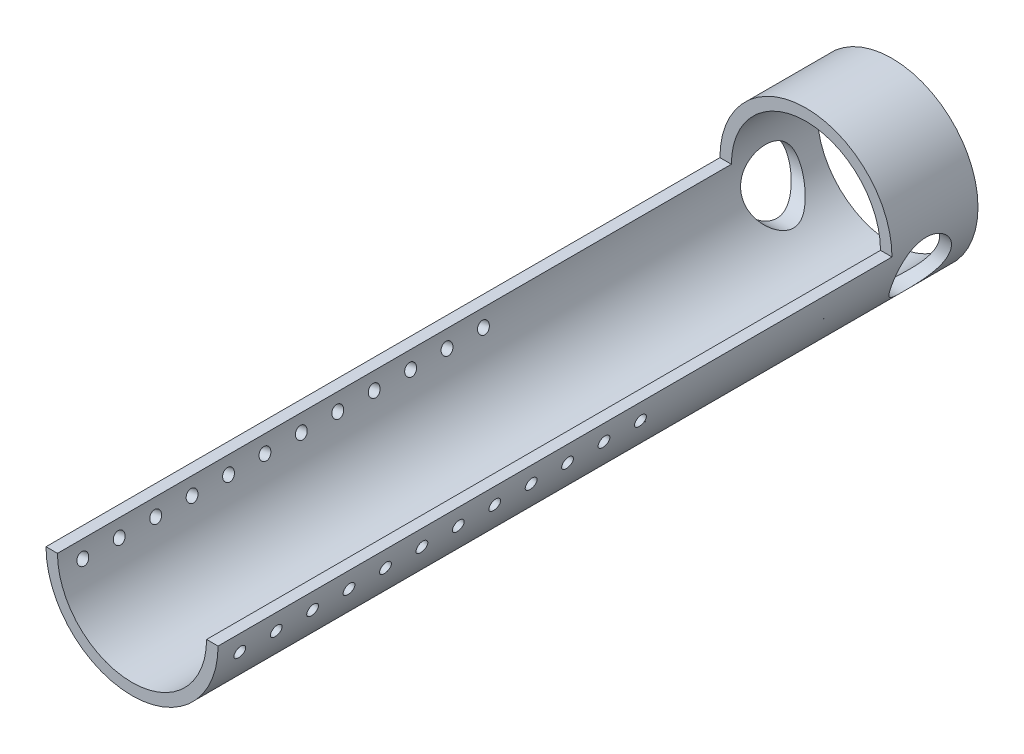
from build123d import *

# Parameters (mm, degrees)
SKETCH1_R               = 30
SKETCH1_R_2             = 26
BOSS_EXTRUDE1_DEPTH     = 132.5
SKETCH3_W               = 60
SKETCH3_H               = 30
CUT_EXTRUDE1_DEPTH      = 235
F_10_32_TAPPED_HOLE1_D  = 4.0386
LPATTERN1_COUNT         = 12
LPATTERN1_PITCH         = 12.7
MIRROR1_COPY_1_D        = 4.0386
MIRROR1_COPY_2_D        = 4.0386
MIRROR1_COPY_3_D        = 4.0386
MIRROR1_COPY_4_D        = 4.0386
MIRROR1_COPY_5_D        = 4.0386
MIRROR1_COPY_6_D        = 4.0386
MIRROR1_COPY_7_D        = 4.0386
MIRROR1_COPY_8_D        = 4.0386
MIRROR1_COPY_9_D        = 4.0386
MIRROR1_COPY_10_D       = 4.0386
MIRROR1_COPY_11_D       = 4.0386
MIRROR1_COPY_12_D       = 4.0386
CUT_EXTRUDE2_DEPTH      = 140.126740918
CUT_EXTRUDE2_DEPTH_BACK = 140.126740918
SKETCH8_R               = 10.16


with BuildPart() as part:
    # Sketch1 → Boss-Extrude1 (new, symmetric)
    with BuildSketch(Plane.XY):
        Circle(SKETCH1_R)
        Circle(SKETCH1_R_2, mode=Mode.SUBTRACT)
    extrude(amount=BOSS_EXTRUDE1_DEPTH, both=True)

    # Sketch3 → Cut-Extrude1 (cut)
    with BuildSketch(Plane.XY.offset(132.5)):
        with Locations((0, 15)):
            Rectangle(SKETCH3_W, SKETCH3_H)
    extrude(amount=-CUT_EXTRUDE1_DEPTH, mode=Mode.SUBTRACT)

    # #10-32 Tapped Hole1 (through all)
    with Locations(Plane(origin=(29.327958333, -6.314337653, 124.245976981), x_dir=(0.210477921772, 0.977598611111, 0), z_dir=(0.977598611111, -0.210477921772, 0))):
        with Locations((0, 0)):
            f_10_32_tapped_hole1 = Hole(F_10_32_TAPPED_HOLE1_D / 2)

    # LPattern1: #10-32 Tapped Hole1 ×12
    with Locations(*[(0, 0, -i * LPATTERN1_PITCH) for i in range(1, LPATTERN1_COUNT)]):
        add(f_10_32_tapped_hole1, mode=Mode.SUBTRACT)

    # Mirror1 copy 1 (through all)
    with Locations(Plane(origin=(-29.327958333, -6.314337653, 111.545976981), x_dir=(-0.210477921772, 0.977598611111, 0), z_dir=(-0.977598611111, -0.210477921772, 0))):
        with Locations((0, 0)):
            Hole(MIRROR1_COPY_1_D / 2)

    # Mirror1 copy 2 (through all)
    with Locations(Plane(origin=(-29.327958333, -6.314337653, 98.845976981), x_dir=(-0.210477921772, 0.977598611111, 0), z_dir=(-0.977598611111, -0.210477921772, 0))):
        with Locations((0, 0)):
            Hole(MIRROR1_COPY_2_D / 2)

    # Mirror1 copy 3 (through all)
    with Locations(Plane(origin=(-29.327958333, -6.314337653, 86.145976981), x_dir=(-0.210477921772, 0.977598611111, 0), z_dir=(-0.977598611111, -0.210477921772, 0))):
        with Locations((0, 0)):
            Hole(MIRROR1_COPY_3_D / 2)

    # Mirror1 copy 4 (through all)
    with Locations(Plane(origin=(-29.327958333, -6.314337653, 73.445976981), x_dir=(-0.210477921772, 0.977598611111, 0), z_dir=(-0.977598611111, -0.210477921772, 0))):
        with Locations((0, 0)):
            Hole(MIRROR1_COPY_4_D / 2)

    # Mirror1 copy 5 (through all)
    with Locations(Plane(origin=(-29.327958333, -6.314337653, 60.745976981), x_dir=(-0.210477921772, 0.977598611111, 0), z_dir=(-0.977598611111, -0.210477921772, 0))):
        with Locations((0, 0)):
            Hole(MIRROR1_COPY_5_D / 2)

    # Mirror1 copy 6 (through all)
    with Locations(Plane(origin=(-29.327958333, -6.314337653, 48.045976981), x_dir=(-0.210477921772, 0.977598611111, 0), z_dir=(-0.977598611111, -0.210477921772, 0))):
        with Locations((0, 0)):
            Hole(MIRROR1_COPY_6_D / 2)

    # Mirror1 copy 7 (through all)
    with Locations(Plane(origin=(-29.327958333, -6.314337653, 35.345976981), x_dir=(-0.210477921772, 0.977598611111, 0), z_dir=(-0.977598611111, -0.210477921772, 0))):
        with Locations((0, 0)):
            Hole(MIRROR1_COPY_7_D / 2)

    # Mirror1 copy 8 (through all)
    with Locations(Plane(origin=(-29.327958333, -6.314337653, 22.645976981), x_dir=(-0.210477921772, 0.977598611111, 0), z_dir=(-0.977598611111, -0.210477921772, 0))):
        with Locations((0, 0)):
            Hole(MIRROR1_COPY_8_D / 2)

    # Mirror1 copy 9 (through all)
    with Locations(Plane(origin=(-29.327958333, -6.314337653, 9.945976981), x_dir=(-0.210477921772, 0.977598611111, 0), z_dir=(-0.977598611111, -0.210477921772, 0))):
        with Locations((0, 0)):
            Hole(MIRROR1_COPY_9_D / 2)

    # Mirror1 copy 10 (through all)
    with Locations(Plane(origin=(-29.327958333, -6.314337653, -2.754023019), x_dir=(-0.210477921772, 0.977598611111, 0), z_dir=(-0.977598611111, -0.210477921772, 0))):
        with Locations((0, 0)):
            Hole(MIRROR1_COPY_10_D / 2)

    # Mirror1 copy 11 (through all)
    with Locations(Plane(origin=(-29.327958333, -6.314337653, -15.454023019), x_dir=(-0.210477921772, 0.977598611111, 0), z_dir=(-0.977598611111, -0.210477921772, 0))):
        with Locations((0, 0)):
            Hole(MIRROR1_COPY_11_D / 2)

    # Mirror1 copy 12 (through all)
    with Locations(Plane(origin=(-29.327958333, -6.314337653, 124.245976981), x_dir=(-0.210477921772, 0.977598611111, 0), z_dir=(-0.977598611111, -0.210477921772, 0))):
        with Locations((0, 0)):
            Hole(MIRROR1_COPY_12_D / 2)

    # Sketch8 → Cut-Extrude2 (cut, two sides: drawn at the far end of the back side and taken through both)
    with BuildSketch(Plane(origin=(0, 0, 0), x_dir=(0, 0, -1), z_dir=(1, 0, 0)).offset(-CUT_EXTRUDE2_DEPTH_BACK)):
        with Locations((114.4025, -10.16)):
            Circle(SKETCH8_R)
    extrude(amount=CUT_EXTRUDE2_DEPTH + CUT_EXTRUDE2_DEPTH_BACK, mode=Mode.SUBTRACT)


solid = part.part
